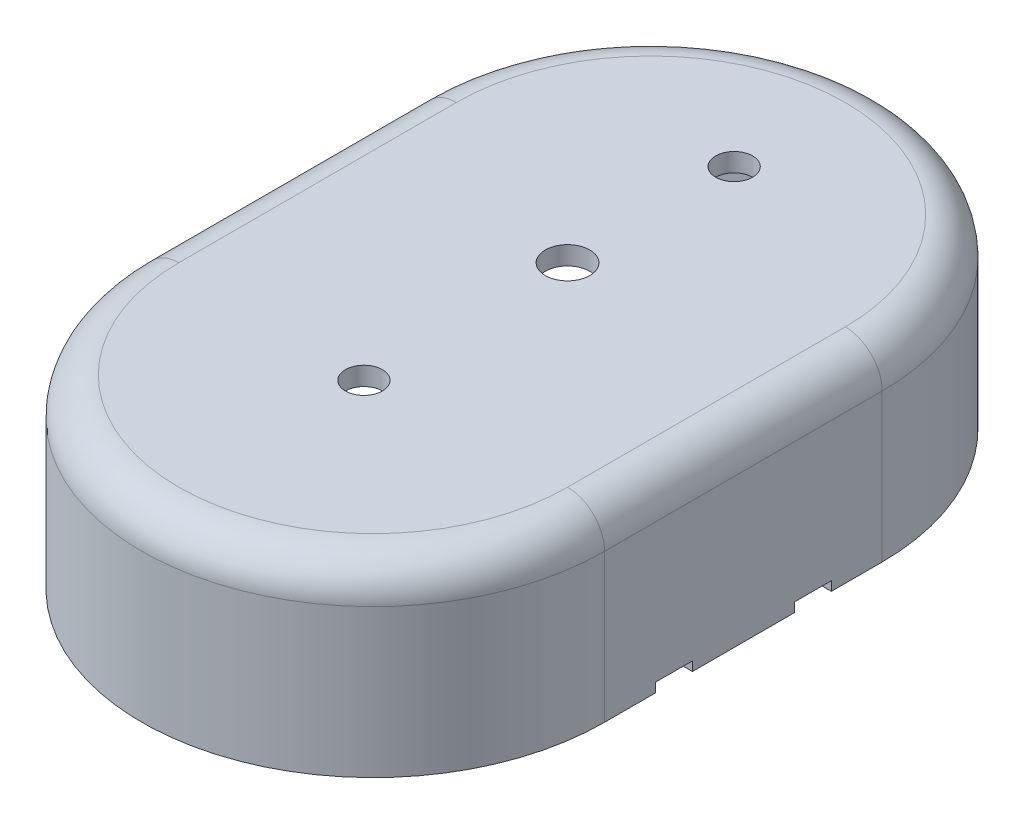
from build123d import *

# Parameters (mm, degrees)
BOSS_EXTRUDE1_DEPTH = 50
FILLET1_R           = 10
SHELL1_T            = -5
CUT_EXTRUDE2_DEPTH  = 2.5
SKETCH5_W           = 10
SKETCH5_H           = 2.5
CUT_EXTRUDE3_DEPTH  = 168.705098402
CUT_EXTRUDE4_REACH  = 130.087
SKETCH6_R           = 5
SKETCH6_R_2         = 6


with BuildPart() as part:
    # Sketch3 → Boss-Extrude1 (new body)
    with BuildSketch(Plane(origin=(0, 0, 0), x_dir=(1, 0, 0), z_dir=(0, 1, 0))):
        with BuildLine():
            Line((-62.5, -37.5), (-62.5, 37.5))
            ThreePointArc((-62.5, 37.5), (0, 100), (62.5, 37.5))
            Line((62.5, 37.5), (62.5, -37.5))
            ThreePointArc((62.5, -37.5), (0, -100), (-62.5, -37.5))
        make_face()
    extrude(amount=BOSS_EXTRUDE1_DEPTH)

    # Fillet1
    fillet1_edges = [part.edges().sort_by_distance(p)[0] for p in [
        (0, 50, 100),
        (62.5, 50, 0),
        (0, 50, -100),
        (-62.5, 50, 0),
    ]]
    fillet(fillet1_edges, radius=FILLET1_R)

    # Shell1
    shell1_openings = [part.faces().sort_by_distance(p)[0] for p in [
        (0, 0, 0),
    ]]
    offset(amount=SHELL1_T, openings=shell1_openings, kind=Kind.INTERSECTION)

    # Sketch4 → Cut-Extrude2 (cut)
    with BuildSketch(Plane.XZ):
        with BuildLine():
            Line((-60, 37.5), (-60, -37.5))
            ThreePointArc((-60, -37.5), (0, -97.5), (60, -37.5))
            Line((60, -37.5), (60, 37.5))
            ThreePointArc((60, 37.5), (0, 97.5), (-60, 37.5))
        make_face()
    extrude(amount=-CUT_EXTRUDE2_DEPTH, mode=Mode.SUBTRACT)

    # Sketch5 → Cut-Extrude3 (cut, through all)
    with BuildSketch(Plane.ZY.offset(62.5)):
        with Locations((-18.75, 1.25)):
            Rectangle(SKETCH5_W, SKETCH5_H)
        with Locations((18.75, 1.25)):
            Rectangle(SKETCH5_W, SKETCH5_H)
    extrude(amount=-CUT_EXTRUDE3_DEPTH, mode=Mode.SUBTRACT)

    # Sketch6 → Cut-Extrude4 (cut, up to next)
    with BuildSketch(Plane(origin=(0, 50, 0), x_dir=(1, 0, 0), z_dir=(0, 1, 0)), mode=Mode.PRIVATE) as cut_extrude4_sk1:
        with Locations(Location((0, 60, 0), (0, 0, 270))):
            Circle(SKETCH6_R)
    cut_extrude4_tool1 = extrude(cut_extrude4_sk1.sketch, amount=-CUT_EXTRUDE4_REACH, mode=Mode.PRIVATE) & part.part
    # Sketch6 → Cut-Extrude4 (cut, up to next)
    with BuildSketch(Plane(origin=(0, 50, 0), x_dir=(1, 0, 0), z_dir=(0, 1, 0)), mode=Mode.PRIVATE) as cut_extrude4_sk2:
        with Locations(Location((0, 15, 0), (0, 0, 270))):
            Circle(SKETCH6_R_2)
    cut_extrude4_tool2 = extrude(cut_extrude4_sk2.sketch, amount=-CUT_EXTRUDE4_REACH, mode=Mode.PRIVATE) & part.part
    # Sketch6 → Cut-Extrude4 (cut, up to next)
    with BuildSketch(Plane(origin=(0, 50, 0), x_dir=(1, 0, 0), z_dir=(0, 1, 0)), mode=Mode.PRIVATE) as cut_extrude4_sk3:
        with Locations(Location((0, -40, 0), (0, 0, 270))):
            Circle(SKETCH6_R)
    cut_extrude4_tool3 = extrude(cut_extrude4_sk3.sketch, amount=-CUT_EXTRUDE4_REACH, mode=Mode.PRIVATE) & part.part
    add(cut_extrude4_tool1.solids().sort_by_distance((0, 50, -60))[0], mode=Mode.SUBTRACT)
    add(cut_extrude4_tool2.solids().sort_by_distance((0, 50, -15))[0], mode=Mode.SUBTRACT)
    add(cut_extrude4_tool3.solids().sort_by_distance((0, 50, 40))[0], mode=Mode.SUBTRACT)


solid = part.part
